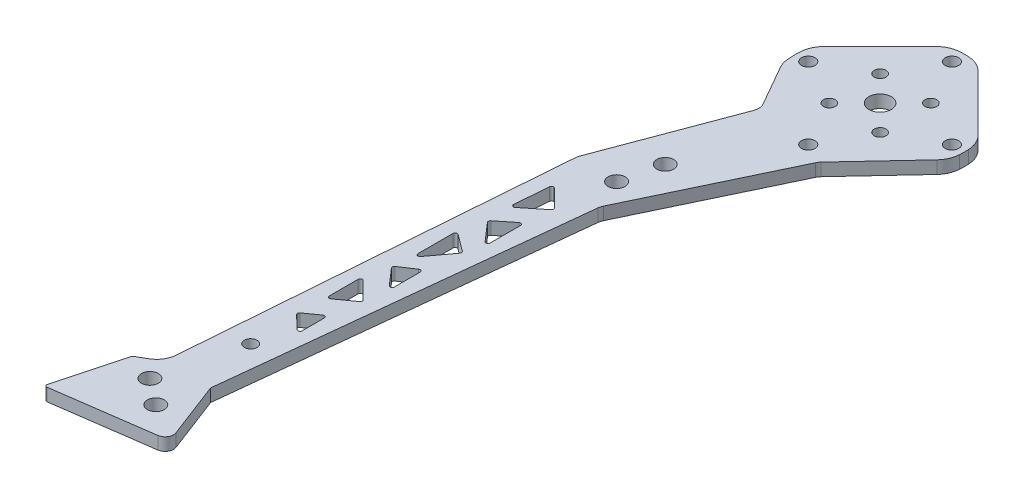
from build123d import *

# Parameters (mm, degrees)
SKETCH_1_R            = 17
EXTRUDE_1_DEPTH       = 3
SKETCH_2_R            = 20
EXTRUDE_2_DEPTH       = 3
CUT_EXTRUDE_2_DEPTH   = 10
FILLET_1_R            = 3
FILLET_2_R            = 6
SKETCH_5_R            = 2.25
CUT_EXTRUDE_6_DEPTH   = 10
SKETCH_6_R            = 14.05
CUT_EXTRUDE_7_DEPTH   = 10
SKETCH_4_R            = 1.5
CUT_EXTRUDE_8_DEPTH   = 10
EXTRUDE_3_DEPTH       = 3
EXTRUDE_4_DEPTH       = 3
CUT_EXTRUDE_19_DEPTH  = 10
FILLET_3_R            = 0.5
CUT_EXTRUDE_20_DEPTH  = 10
SKETCH_39_R           = 1.65
CUT_EXTRUDE_32_DEPTH  = 10
SKETCH_40_R           = 1.65
SKETCH_40_R_2         = 1.6
EXTRUDE_5_DEPTH       = 3
SKETCH_108_R          = 2.1
CUT_EXTRUDE_99_DEPTH  = 313.834538804
SKETCH_130_R          = 14.05
SKETCH_130_R_2        = 2.65
EXTRUDE_7_DEPTH       = 3
SKETCH_131_R          = 1.5
CUT_EXTRUDE_122_DEPTH = 10
EXTRUDE_9_DEPTH       = 3
SKETCH_133_R          = 2.6
CUT_EXTRUDE_125_DEPTH = 292.199887495
SKETCH_134_R          = 1.5
SKETCH_134_R_2        = 1.4
EXTRUDE_10_DEPTH      = 3
EXTRUDE_11_DEPTH      = 3
SKETCH_137_W          = 2
SKETCH_137_H          = 3
CUT_EXTRUDE_126_DEPTH = 3
SKETCH_138_R          = 2.6
EXTRUDE_12_DEPTH      = 3
SKETCH_139_R          = 2.5
CUT_EXTRUDE_127_DEPTH = 5
SKETCH_140_R          = 2.5
EXTRUDE_13_DEPTH      = 3
SKETCH_141_R          = 2.5
CUT_EXTRUDE_128_DEPTH = 5
FILLET_4_R            = 0.5
SKETCH_143_W          = 2
SKETCH_143_H          = 3
EXTRUDE_14_DEPTH      = 4
SKETCH_144_R          = 2
CUT_EXTRUDE_129_DEPTH = 4
SKETCH_145_R          = 2.1
EXTRUDE_15_DEPTH      = 3
FILLET_6_R            = 2
EXTRUDE_16_DEPTH      = 3
FILLET_7_R            = 5
FILLET_8_R            = 0.5
SKETCH_147_R          = 2.1
EXTRUDE_17_DEPTH      = 3
SKETCH_148_R          = 2
CUT_EXTRUDE_130_DEPTH = 6
EXTRUDE_18_DEPTH      = 3
SKETCH_150_R          = 2
CUT_EXTRUDE_131_DEPTH = 10
EXTRUDE_START         = -3
SKETCH_151_R          = 2.5
EXTRUDE_19_DEPTH      = 3
EXTRUDE_20_DEPTH      = 3
SKETCH_159_R          = 1.5
CUT_EXTRUDE_138_DEPTH = 329.706278544


with BuildPart() as part:
    # 草图1 → 凸台-拉伸1 (new body)
    with BuildSketch(Plane(origin=(0, 0, 0), x_dir=(1, 0, 0), z_dir=(0, 1, 0))):
        with BuildLine():
            Line((55.174801085, -164.459776844), (68.150536307, -171.985087167))
            Line((68.150536307, -171.985087167), (86.580547938, -133.34236439))
            ThreePointArc((86.580547938, -133.34236439), (76.841427209, -134.371653113), (68.150536307, -129.857417501))
            Line((68.150536307, -129.857417501), (55.174801085, -164.459776844))
        make_face()
        Polygon((68.150536307, -171.985087167), (55.174801085, -164.459776844), (47.261962171, -267.008923523), (57.886031057, -267.008923523), align=None)
        with Locations((79.999999942, -117.667659031)):
            Circle(SKETCH_1_R)
    extrude(amount=EXTRUDE_1_DEPTH)

    # 草图2 → 凸台-拉伸2 (add)
    with BuildSketch(Plane(origin=(0, 3, 0), x_dir=(1, 0, 0), z_dir=(0, 1, 0))):
        with Locations((79.999999942, -117.667659031)):
            Circle(SKETCH_2_R)
    extrude(amount=-EXTRUDE_2_DEPTH)

    # 草图3 → 切除-拉伸2 (cut)
    with BuildSketch(Plane(origin=(0, 3, 0), x_dir=(1, 0, 0), z_dir=(0, 1, 0))):
        with BuildLine():
            ThreePointArc((84.795984272, -137.084109127), (94.612149468, -131.323613273), (99.696155003, -121.140622585))
            Line((99.696155003, -121.140622585), (84.795984272, -137.084109127))
        make_face()
        with BuildLine():
            Line((83.472963496, -97.971503971), (99.696155003, -114.194695478))
            ThreePointArc((99.696155003, -114.194695478), (94.142135566, -103.525523408), (83.472963496, -97.971503971))
        make_face()
        with BuildLine():
            Line((60.303844882, -114.194695478), (76.527036389, -97.971503971))
            ThreePointArc((76.527036389, -97.971503971), (65.857864319, -103.525523408), (60.303844882, -114.194695478))
        make_face()
        with BuildLine():
            Line((67.016814864, -132.880709522), (60.303844882, -121.140622585))
            ThreePointArc((60.303844882, -121.140622585), (62.637908239, -127.595285722), (67.016814864, -132.880709522))
        make_face()
    extrude(amount=-CUT_EXTRUDE_2_DEPTH, mode=Mode.SUBTRACT)

    # 圆角1
    fillet_1_edges = [part.edges().sort_by_distance(p)[0] for p in [
        (68.150536307, 1.5, 171.985087167),
        (55.174801085, 1.5, 164.459776844),
        (67.016814864, 1.5, 132.880709522),
        (84.795984272, 1.5, 137.084109127),
    ]]
    fillet(fillet_1_edges, radius=FILLET_1_R)

    # 圆角2
    fillet_2_edges = [part.edges().sort_by_distance(p)[0] for p in [
        (99.696155003, 1.5, 121.140622585),
        (83.472963496, 1.5, 97.971503971),
        (99.696155003, 1.5, 114.194695478),
        (76.527036389, 1.5, 97.971503971),
        (60.303844882, 1.5, 114.194695478),
        (60.303844882, 1.5, 121.140622585),
    ]]
    fillet(fillet_2_edges, radius=FILLET_2_R)

    # 草图5 → 切除-拉伸6 (cut)
    with BuildSketch(Plane(origin=(0, 3, 0), x_dir=(1, 0, 0), z_dir=(0, 1, 0))):
        with Locations(Location((79.999999942, -117.667659031, 0), (0, 0, 270))):
            Circle(SKETCH_5_R)
    extrude(amount=-CUT_EXTRUDE_6_DEPTH, mode=Mode.SUBTRACT)

    # 草图6 → 切除-拉伸7 (cut)
    with BuildSketch(Plane(origin=(0, 3, 0), x_dir=(1, 0, 0), z_dir=(0, 1, 0))):
        with Locations(Location((79.999999942, -117.667659031, 0), (0, 0, 270))):
            Circle(SKETCH_6_R)
    extrude(amount=-CUT_EXTRUDE_7_DEPTH, mode=Mode.SUBTRACT)

    # 草图4 → 切除-拉伸8 (cut)
    with BuildSketch(Plane(origin=(0, 3, 0), x_dir=(1, 0, 0), z_dir=(0, 1, 0))):
        with Locations(Location((79.999999942, -100.667659031, 0), (0, 0, 270))):
            Circle(SKETCH_4_R)
        with Locations(Location((96.999999942, -117.667659031, 0), (0, 0, 270))):
            Circle(SKETCH_4_R)
        with Locations(Location((79.999999942, -134.667659031, 0), (0, 0, 270))):
            Circle(SKETCH_4_R)
        with Locations(Location((62.999999942, -117.667659031, 0), (0, 0, 270))):
            Circle(SKETCH_4_R)
    extrude(amount=-CUT_EXTRUDE_8_DEPTH, mode=Mode.SUBTRACT)

    # 草图14 → 凸台-拉伸3 (add)
    with BuildSketch(Plane(origin=(0, 3, 0), x_dir=(1, 0, 0), z_dir=(0, 1, 0))):
        Polygon((57.886031057, -267.008923523), (47.261962171, -267.008923523), (46.840068855, -271.980005375), (57.349053203, -271.980005375), align=None)
    extrude(amount=-EXTRUDE_3_DEPTH)

    # 草图23 → 凸台-拉伸4 (add)
    with BuildSketch(Plane(origin=(0, 3, 0), x_dir=(1, 0, 0), z_dir=(0, 1, 0))):
        Polygon((46.840068855, -271.980005375), (46.713220593, -273.474632258), (57.349053203, -271.980005375), align=None)
    extrude(amount=-EXTRUDE_4_DEPTH)

    # 草图25 → 切除-拉伸19 (cut)
    with BuildSketch(Plane(origin=(0, 3, 0), x_dir=(1, 0, 0), z_dir=(0, 1, 0))):
        Polygon((63.358234199, -178.101158645), (58.109236028, -172.852160473), (57.330454141, -182.945051137), align=None)
        Polygon((62.538578946, -184.233800284), (57.63878544, -188.17124869), (62.538578946, -193.820898548), align=None)
        Polygon((56.173532683, -193.927598865), (61.335747795, -197.752627098), (56.173532683, -204.719494594), align=None)
        Polygon((59.597561096, -219.579669638), (54.348562925, -214.330671467), (54.348562925, -223.339301679), align=None)
        Polygon((58.288084355, -226.491086055), (53.878112336, -229.649759683), (58.288084355, -233.898247055), align=None)
        Polygon((53.007833014, -235.846965216), (57.603103282, -239.251906337), (53.007833014, -245.453631443), align=None)
        Polygon((60.218961992, -205.799827801), (55.607108021, -208.854279476), (60.218961992, -214.171924004), align=None)
    extrude(amount=-CUT_EXTRUDE_19_DEPTH, mode=Mode.SUBTRACT)

    # 圆角3
    fillet_3_edges = [part.edges().sort_by_distance(p)[0] for p in [
        (63.358234199, 1.5, 178.101158645),
        (57.330454141, 1.5, 182.945051137),
        (58.109236028, 1.5, 172.852160473),
        (60.218961992, 1.5, 205.799827801),
        (60.218961992, 1.5, 214.171924004),
        (55.607108021, 1.5, 208.854279476),
        (53.007833014, 1.5, 245.453631443),
        (53.007833014, 1.5, 235.846965216),
        (57.603103282, 1.5, 239.251906337),
        (58.288084355, 1.5, 226.491086055),
        (58.288084355, 1.5, 233.898247055),
        (53.878112336, 1.5, 229.649759683),
        (59.597561096, 1.5, 219.579669638),
        (54.348562925, 1.5, 223.339301679),
        (54.348562925, 1.5, 214.330671467),
        (56.173532683, 1.5, 204.719494594),
        (56.173532683, 1.5, 193.927598865),
        (61.335747795, 1.5, 197.752627098),
        (62.538578946, 1.5, 184.233800284),
        (62.538578946, 1.5, 193.820898548),
        (57.63878544, 1.5, 188.17124869),
    ]]
    fillet(fillet_3_edges, radius=FILLET_3_R)

    # 草图26 → 切除-拉伸20 (cut)
    with BuildSketch(Plane(origin=(0, 3, 0), x_dir=(1, 0, 0), z_dir=(0, 1, 0))):
        Polygon((79.122764012, -141.279254323), (66.169916498, -165.580171781), (64.404980214, -164.639427441), (76.175052505, -142.557521904), align=None)
        Polygon((70.29001636, -138.528207063), (65.287448356, -156.295387281), (63.362303252, -155.753339011), (69.263859074, -134.79330293), align=None)
    extrude(amount=-CUT_EXTRUDE_20_DEPTH, mode=Mode.SUBTRACT)

    # 草图39 → 切除-拉伸32 (cut)
    with BuildSketch(Plane(origin=(0, 3, 0), x_dir=(1, 0, 0), z_dir=(0, 1, 0))):
        with Locations(Location((62.999999942, -117.667659031, 0), (0, 0, 270))):
            Circle(SKETCH_39_R)
        with Locations(Location((79.999999942, -100.667659031, 0), (0, 0, 270))):
            Circle(SKETCH_39_R)
        with Locations(Location((96.999999942, -117.667659031, 0), (0, 0, 270))):
            Circle(SKETCH_39_R)
        with Locations(Location((79.999999942, -134.667659031, 0), (0, 0, 270))):
            Circle(SKETCH_39_R)
    extrude(amount=-CUT_EXTRUDE_32_DEPTH, mode=Mode.SUBTRACT)

    # 草图40 → 凸台-拉伸5 (add)
    # profile 1 of 4: a face of its own
    with BuildSketch(Plane(origin=(0, 3, 0), x_dir=(1, 0, 0), z_dir=(0, 1, 0))):
        with Locations((62.999999942, -117.667659031)):
            Circle(SKETCH_40_R)
        with Locations(Location((62.999999942, -117.667659031, 0), (0, 0, 270))):
            Circle(SKETCH_40_R_2, mode=Mode.SUBTRACT)
    # profile 2 of 4: a face of its own
    with BuildSketch(Plane(origin=(0, 3, 0), x_dir=(1, 0, 0), z_dir=(0, 1, 0))):
        with Locations((79.999999942, -134.667659031)):
            Circle(SKETCH_40_R)
        with Locations(Location((79.999999942, -134.667659031, 0), (0, 0, 270))):
            Circle(SKETCH_40_R_2, mode=Mode.SUBTRACT)
    # profile 3 of 4: a face of its own
    with BuildSketch(Plane(origin=(0, 3, 0), x_dir=(1, 0, 0), z_dir=(0, 1, 0))):
        with Locations((96.999999942, -117.667659031)):
            Circle(SKETCH_40_R)
        with Locations(Location((96.999999942, -117.667659031, 0), (0, 0, 270))):
            Circle(SKETCH_40_R_2, mode=Mode.SUBTRACT)
    # profile 4 of 4: a face of its own
    with BuildSketch(Plane(origin=(0, 3, 0), x_dir=(1, 0, 0), z_dir=(0, 1, 0))):
        with Locations((79.999999942, -100.667659031)):
            Circle(SKETCH_40_R)
        with Locations(Location((79.999999942, -100.667659031, 0), (0, 0, 270))):
            Circle(SKETCH_40_R_2, mode=Mode.SUBTRACT)
    extrude(amount=-EXTRUDE_5_DEPTH)

    # 草图108 → 切除-拉伸99 (cut, through all)
    with BuildSketch(Plane(origin=(204.073008221, 6, 3.164910075), x_dir=(-0.9080868734254056, 0, 0.41878184095358223), z_dir=(0, 1, 0))):
        with Locations(Location((246.232295139, 173.568228153, 0), (0, 0, 335.242296119))):
            Circle(SKETCH_108_R)
    extrude(amount=-CUT_EXTRUDE_99_DEPTH, mode=Mode.SUBTRACT)

    # 草图130 → 凸台-拉伸7 (add)
    with BuildSketch(Plane(origin=(0, 3, 0), x_dir=(1, 0, 0), z_dir=(0, 1, 0))):
        with Locations((79.999999942, -117.667659031)):
            Circle(SKETCH_130_R)
        with Locations(Location((79.999999942, -117.667659031, 0), (0, 0, 270))):
            Circle(SKETCH_130_R_2, mode=Mode.SUBTRACT)
    extrude(amount=-EXTRUDE_7_DEPTH)

    # 草图131 → 切除-拉伸122 (cut)
    with BuildSketch(Plane(origin=(0, 3, 0), x_dir=(1, 0, 0), z_dir=(0, 1, 0))):
        with Locations(Location((73.989592302, -111.657251391, 0), (0, 0, 270))):
            Circle(SKETCH_131_R)
        with Locations(Location((73.989592302, -123.678066672, 0), (0, 0, 270))):
            Circle(SKETCH_131_R)
        with Locations(Location((86.010407582, -123.678066672, 0), (0, 0, 270))):
            Circle(SKETCH_131_R)
        with Locations(Location((86.010407582, -111.657251391, 0), (0, 0, 270))):
            Circle(SKETCH_131_R)
    extrude(amount=-CUT_EXTRUDE_122_DEPTH, mode=Mode.SUBTRACT)

    # 草图132 → 凸台-拉伸9 (add)
    with BuildSketch(Plane(origin=(0, 3, 0), x_dir=(1, 0, 0), z_dir=(0, 1, 0))):
        Polygon((76.175052505, -142.557521904), (70.29001636, -153.598474673), (72.646340255, -153.429713052), (79.122764012, -141.279254323), align=None)
        Polygon((69.263859074, -134.79330293), (66.313081163, -145.27332097), (67.788732358, -147.411797172), (70.29001636, -138.528207063), align=None)
    extrude(amount=-EXTRUDE_9_DEPTH)

    # 草图133 → 切除-拉伸125 (cut, through all)
    with BuildSketch(Plane(origin=(0, 3, 0), x_dir=(1, 0, 0), z_dir=(0, 1, 0))):
        with Locations(Location((70.832507853, -139.499437292, 0), (0, 0, 270))):
            Circle(SKETCH_133_R)
    extrude(amount=-CUT_EXTRUDE_125_DEPTH, mode=Mode.SUBTRACT)

    # 草图134 → 凸台-拉伸10 (add)
    # profile 1 of 4: a face of its own
    with BuildSketch(Plane(origin=(0, 3, 0), x_dir=(1, 0, 0), z_dir=(0, 1, 0))):
        with Locations((73.989592302, -111.657251391)):
            Circle(SKETCH_134_R)
        with Locations(Location((73.989592302, -111.657251391, 0), (0, 0, 270))):
            Circle(SKETCH_134_R_2, mode=Mode.SUBTRACT)
    # profile 2 of 4: a face of its own
    with BuildSketch(Plane(origin=(0, 3, 0), x_dir=(1, 0, 0), z_dir=(0, 1, 0))):
        with Locations((86.010407582, -111.657251391)):
            Circle(SKETCH_134_R)
        with Locations(Location((86.010407582, -111.657251391, 0), (0, 0, 270))):
            Circle(SKETCH_134_R_2, mode=Mode.SUBTRACT)
    # profile 3 of 4: a face of its own
    with BuildSketch(Plane(origin=(0, 3, 0), x_dir=(1, 0, 0), z_dir=(0, 1, 0))):
        with Locations((73.989592302, -123.678066672)):
            Circle(SKETCH_134_R)
        with Locations(Location((73.989592302, -123.678066672, 0), (0, 0, 270))):
            Circle(SKETCH_134_R_2, mode=Mode.SUBTRACT)
    # profile 4 of 4: a face of its own
    with BuildSketch(Plane(origin=(0, 3, 0), x_dir=(1, 0, 0), z_dir=(0, 1, 0))):
        with Locations((86.010407582, -123.678066672)):
            Circle(SKETCH_134_R)
        with Locations(Location((86.010407582, -123.678066672, 0), (0, 0, 270))):
            Circle(SKETCH_134_R_2, mode=Mode.SUBTRACT)
    extrude(amount=-EXTRUDE_10_DEPTH)

    # 草图136 → 凸台-拉伸11 (add)
    with BuildSketch(Plane(origin=(0, 3, 0), x_dir=(1, 0, 0), z_dir=(0, 1, 0))):
        Polygon((67.788732358, -147.411797172), (66.313081163, -145.27332097), (65.500008758, -148.161038627), (66.975659953, -150.299514829), align=None)
    extrude(amount=-EXTRUDE_11_DEPTH)

    # 草图137 → 切除-拉伸126 (cut)
    with BuildSketch(Plane(origin=(-35.978772546, 0, 127.782637912), x_dir=(-0.9625725521853279, 0, -0.2710241350496748), z_dir=(0.2710241350496748, 0, -0.9625725521853279))):
        with Locations((-104.20372794, 1.5)):
            Rectangle(SKETCH_137_W, SKETCH_137_H)
    extrude(amount=-CUT_EXTRUDE_126_DEPTH, mode=Mode.SUBTRACT)

    # 草图138 → 凸台-拉伸12 (add)
    with BuildSketch(Plane(origin=(0, 3, 0), x_dir=(1, 0, 0), z_dir=(0, 1, 0))):
        with Locations((70.832507853, -139.499437292)):
            Circle(SKETCH_138_R)
    extrude(amount=-EXTRUDE_12_DEPTH)

    # 草图139 → 切除-拉伸127 (cut)
    with BuildSketch(Plane(origin=(0, 3, 0), x_dir=(1, 0, 0), z_dir=(0, 1, 0))):
        with Locations(Location((68.467751412, -144.094745685, 0), (0, 0, 270))):
            Circle(SKETCH_139_R)
    extrude(amount=-CUT_EXTRUDE_127_DEPTH, mode=Mode.SUBTRACT)

    # 草图140 → 凸台-拉伸13 (add)
    with BuildSketch(Plane(origin=(0, 3, 0), x_dir=(1, 0, 0), z_dir=(0, 1, 0))):
        with Locations((68.467751412, -144.094745685)):
            Circle(SKETCH_140_R)
    extrude(amount=-EXTRUDE_13_DEPTH)

    # 草图141 → 切除-拉伸128 (cut)
    with BuildSketch(Plane.XZ):
        with Locations(Location((71.254299744, 146.127686011, 0), (0, 0, 270))):
            Circle(SKETCH_141_R)
    extrude(amount=-CUT_EXTRUDE_128_DEPTH, mode=Mode.SUBTRACT)

    # 圆角4
    fillet_4_edges = [part.edges().sort_by_distance(p)[0] for p in [
        (57.349053203, 1.5, 271.980005375),
        (46.713220593, 1.5, 273.474632258),
    ]]
    fillet(fillet_4_edges, radius=FILLET_4_R)

    # 草图143 → 凸台-拉伸14 (add)
    with BuildSketch(Plane(origin=(-54.090325082, 0, 101.479193958), x_dir=(-0.8824681420079096, 0, -0.47037217003252635), z_dir=(0.47037217003252635, 0, -0.8824681420079096))):
        with Locations((-135.277147984, 1.5)):
            Rectangle(SKETCH_143_W, SKETCH_143_H)
    extrude(amount=EXTRUDE_14_DEPTH)

    # 草图144 → 切除-拉伸129 (cut)
    with BuildSketch(Plane(origin=(0, 3, 0), x_dir=(1, 0, 0), z_dir=(0, 1, 0))):
        with Locations(Location((64.915803208, -164.949805192, 0), (0, 0, 270))):
            Circle(SKETCH_144_R)
    extrude(amount=-CUT_EXTRUDE_129_DEPTH, mode=Mode.SUBTRACT)

    # 草图145 → 凸台-拉伸15 (add)
    with BuildSketch(Plane(origin=(0, 3, 0), x_dir=(1, 0, 0), z_dir=(0, 1, 0))):
        Polygon((47.334024019, -273.38739231), (56.963354433, -272.034206656), (65.145851399, -270.884340879), (59.156751189, -255.245209741), (48.169667161, -255.245209741), (38.934443502, -274.567764294), align=None)
        with Locations(Location((53.159915309, -263.897553566, 0), (0, 0, 180))):
            Circle(SKETCH_145_R, mode=Mode.SUBTRACT)
    extrude(amount=-EXTRUDE_15_DEPTH)

    # 圆角6
    fillet_6_edges = [part.edges().sort_by_distance(p)[0] for p in [
        (65.145851399, 1.5, 270.884340879),
    ]]
    fillet(fillet_6_edges, radius=FILLET_6_R)

    # 草图146 → 凸台-拉伸16 (add)
    with BuildSketch(Plane(origin=(0, 3, 0), x_dir=(1, 0, 0), z_dir=(0, 1, 0))):
        Polygon((38.934443502, -274.567764294), (43.396637102, -258.028819792), (48.169667161, -255.245209741), align=None)
    extrude(amount=-EXTRUDE_16_DEPTH)

    # 圆角7
    fillet_7_edges = [part.edges().sort_by_distance(p)[0] for p in [
        (48.169667161, 1.5, 255.245209741),
    ]]
    fillet(fillet_7_edges, radius=FILLET_7_R)

    # 圆角8
    fillet_8_edges = [part.edges().sort_by_distance(p)[0] for p in [
        (38.934443502, 1.5, 274.567764294),
        (43.396637102, 1.5, 258.028819792),
    ]]
    fillet(fillet_8_edges, radius=FILLET_8_R)

    # 草图147 → 凸台-拉伸17 (add)
    with BuildSketch(Plane(origin=(0, 3, 0), x_dir=(1, 0, 0), z_dir=(0, 1, 0))):
        with Locations((53.159915309, -263.897553566)):
            Circle(SKETCH_147_R)
    extrude(amount=-EXTRUDE_17_DEPTH)

    # 草图148 → 切除-拉伸130 (cut)
    with BuildSketch(Plane(origin=(0, 3, 0), x_dir=(1, 0, 0), z_dir=(0, 1, 0))):
        with Locations(Location((56.123223174, -265.193283643, 0), (0, 0, 270))):
            Circle(SKETCH_148_R)
        with Locations(Location((50.02308315, -260.494132715, 0), (0, 0, 270))):
            Circle(SKETCH_148_R)
    extrude(amount=-CUT_EXTRUDE_130_DEPTH, mode=Mode.SUBTRACT)

    # 草图149 → 凸台-拉伸18 (add)
    with BuildSketch(Plane(origin=(0, 3, 0), x_dir=(1, 0, 0), z_dir=(0, 1, 0))):
        Polygon((64.474375951, -159.183104937), (66.975659953, -150.299514829), (65.500008758, -148.161038627), (62.549230847, -158.641056667), align=None)
        Polygon((70.29001636, -153.598474673), (72.646340255, -153.429713052), (68.051405178, -162.050299213), (66.286468894, -161.109554873), align=None)
    extrude(amount=-EXTRUDE_18_DEPTH)

    # 草图150 → 切除-拉伸131 (cut)
    with BuildSketch(Plane(origin=(0, 3, 0), x_dir=(1, 0, 0), z_dir=(0, 1, 0))):
        with Locations(Location((67.132054255, -155.64467573, 0), (0, 0, 270))):
            Circle(SKETCH_150_R)
    extrude(amount=-CUT_EXTRUDE_131_DEPTH, mode=Mode.SUBTRACT)

    # 草图151 → 凸台-拉伸19 (add)
    with BuildSketch(Plane(origin=(0, 3, 0), x_dir=(1, 0, 0), z_dir=(0, 1, 0)).offset(EXTRUDE_START)):
        with Locations((71.254299744, -146.127686011)):
            Circle(SKETCH_151_R)
    extrude(amount=EXTRUDE_19_DEPTH)

    # 草图158 → 凸台-拉伸20 (add)
    with BuildSketch(Plane(origin=(0, 3, 0), x_dir=(1, 0, 0), z_dir=(0, 1, 0)).offset(EXTRUDE_START)):
        with BuildLine():
            Line((53.909568235, -244.236659723), (57.305430959, -239.653641559))
            ThreePointArc((57.305430959, -239.653641559), (57.398251555, -239.282385655), (57.20136806, -238.954234014))
            Line((57.20136806, -238.954234014), (53.805505337, -236.43801365))
            ThreePointArc((53.805505337, -236.43801365), (53.282928769, -236.393186355), (53.007833014, -236.839748871))
            Line((53.007833014, -236.839748871), (53.007833014, -243.9389874))
            ThreePointArc((53.007833014, -243.9389874), (53.351096947, -244.4137861), (53.909568235, -244.236659723))
        make_face()
    extrude(amount=EXTRUDE_20_DEPTH)

    # 草图159 → 切除-拉伸138 (cut, through all)
    with BuildSketch(Plane(origin=(158.718859572, 3, -31.692081328), x_dir=(-0.716134735249356, 0, 0.6979620627006419), z_dir=(0, 1, 0))):
        with Locations(Location((265.042079437, 123.15020419, 0), (0, 0, 45.736272176))):
            Circle(SKETCH_159_R)
    extrude(amount=-CUT_EXTRUDE_138_DEPTH, mode=Mode.SUBTRACT)


solid = part.part
